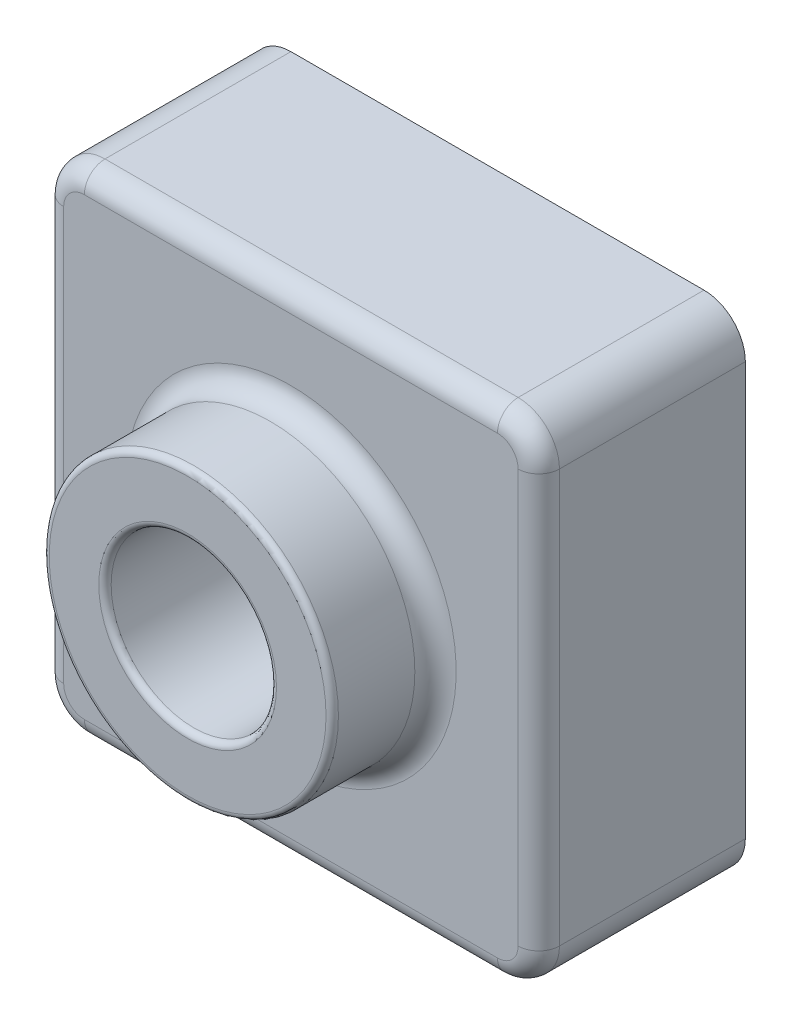
from build123d import *

# Parameters (mm, degrees)
SKETCH1_W           = 120
SKETCH1_H           = 120
BOSS_EXTRUDE1_DEPTH = 50
SKETCH2_R           = 35
BOSS_EXTRUDE2_DEPTH = 25
SKETCH5_R           = 20.010054985
CUT_EXTRUDE1_DEPTH  = 186.539753153
FILLET1_R           = 10
FILLET2_R           = 1.5
FILLET3_R           = 5
SHELL1_T            = -2


with BuildPart() as part:
    # Sketch1 → Boss-Extrude1 (new body)
    with BuildSketch(Plane.XY):
        with Locations((60, 60)):
            Rectangle(SKETCH1_W, SKETCH1_H)
    extrude(amount=BOSS_EXTRUDE1_DEPTH)

    # Sketch2 → Boss-Extrude2 (add)
    with BuildSketch(Plane.XY.offset(50)):
        with Locations((60, 60)):
            Circle(SKETCH2_R)
    extrude(amount=BOSS_EXTRUDE2_DEPTH)

    # Sketch5 → Cut-Extrude1 (cut, through all)
    with BuildSketch(Plane.XY.offset(75)):
        with Locations((60, 60)):
            Circle(SKETCH5_R)
    extrude(amount=-CUT_EXTRUDE1_DEPTH, mode=Mode.SUBTRACT)

    # Fillet1
    fillet1_edges = [part.edges().sort_by_distance(p)[0] for p in [
        (0, 120, 25),
        (120, 120, 25),
        (120, 0, 25),
        (0, 0, 25),
    ]]
    fillet(fillet1_edges, radius=FILLET1_R)

    # Fillet2
    fillet2_edges = [part.edges().sort_by_distance(p)[0] for p in [
        (25, 60, 75),
        (39.989945015, 60, 75),
    ]]
    fillet(fillet2_edges, radius=FILLET2_R)

    # Fillet3
    fillet3_edges = [part.edges().sort_by_distance(p)[0] for p in [
        (25, 60, 50),
        (60, 0, 50),
        (0, 60, 50),
        (120, 60, 50),
        (60, 120, 50),
        (117.071067812, 117.071067812, 50),
        (117.071067812, 2.928932188, 50),
        (2.928932188, 117.071067812, 50),
        (2.928932188, 2.928932188, 50),
    ]]
    fillet(fillet3_edges, radius=FILLET3_R)

    # Shell1
    shell1_openings = [part.faces().sort_by_distance(p)[0] for p in [
        (60, 1.697056275, 0),
    ]]
    offset(amount=SHELL1_T, openings=shell1_openings, kind=Kind.INTERSECTION)


solid = part.part
